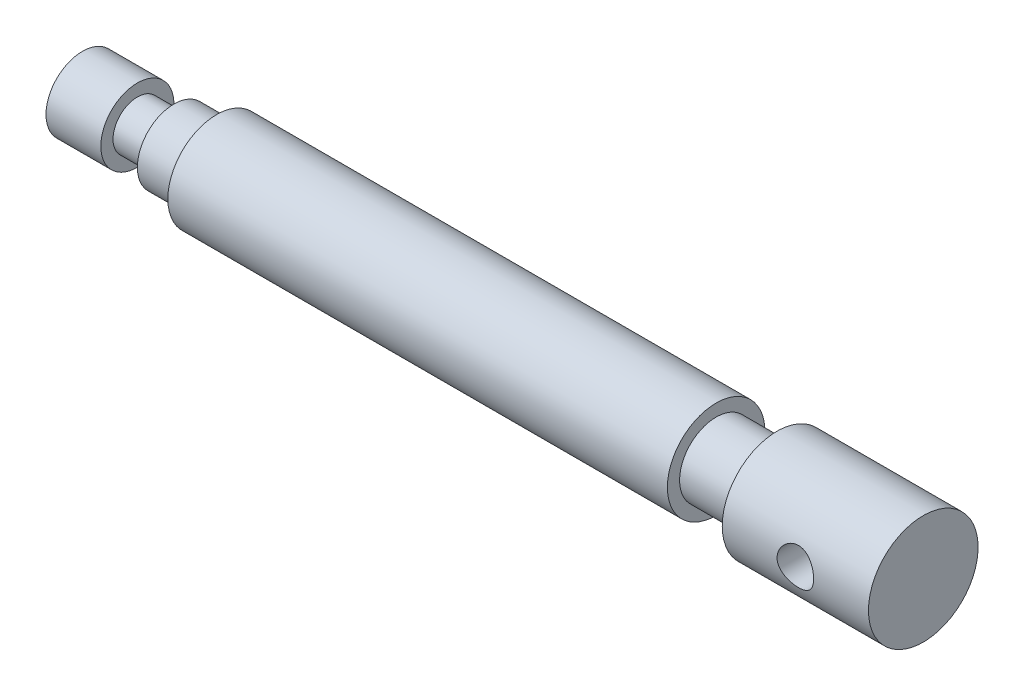
from build123d import *

# Parameters (mm, degrees)
CUT_EXTRUDE1_DEPTH      = 71.164093381
CUT_EXTRUDE1_DEPTH_BACK = 71.164093381
SKETCH2_R               = 3


with BuildPart() as part:
    # Sketch1 → Revolve1 (revolve)
    with BuildSketch(Plane(origin=(0, 0, 0), x_dir=(1, 0, 0), z_dir=(0, 1, 0)), mode=Mode.PRIVATE) as revolve1_sk:
        Polygon((69, 0), (69, 9), (45, 9), (45, 6), (35, 6), (35, 8), (-47, 8), (-47, 6), (-54, 6), (-54, 4), (-60, 4), (-60, 6), (-69, 6), (-69, 0), align=None)
    revolve(revolve1_sk.sketch.rotate(Axis((0, 0, 0), (1, 0, 0)), 180), axis=Axis((0, 0, 0), (1, 0, 0)))

    # Sketch2 → Cut-Extrude1 (cut, two sides: drawn at the far end of the back side and taken through both)
    with BuildSketch(Plane.XY.offset(-CUT_EXTRUDE1_DEPTH_BACK)):
        with Locations((57, 0)):
            Circle(SKETCH2_R)
    extrude(amount=CUT_EXTRUDE1_DEPTH + CUT_EXTRUDE1_DEPTH_BACK, mode=Mode.SUBTRACT)


solid = part.part
